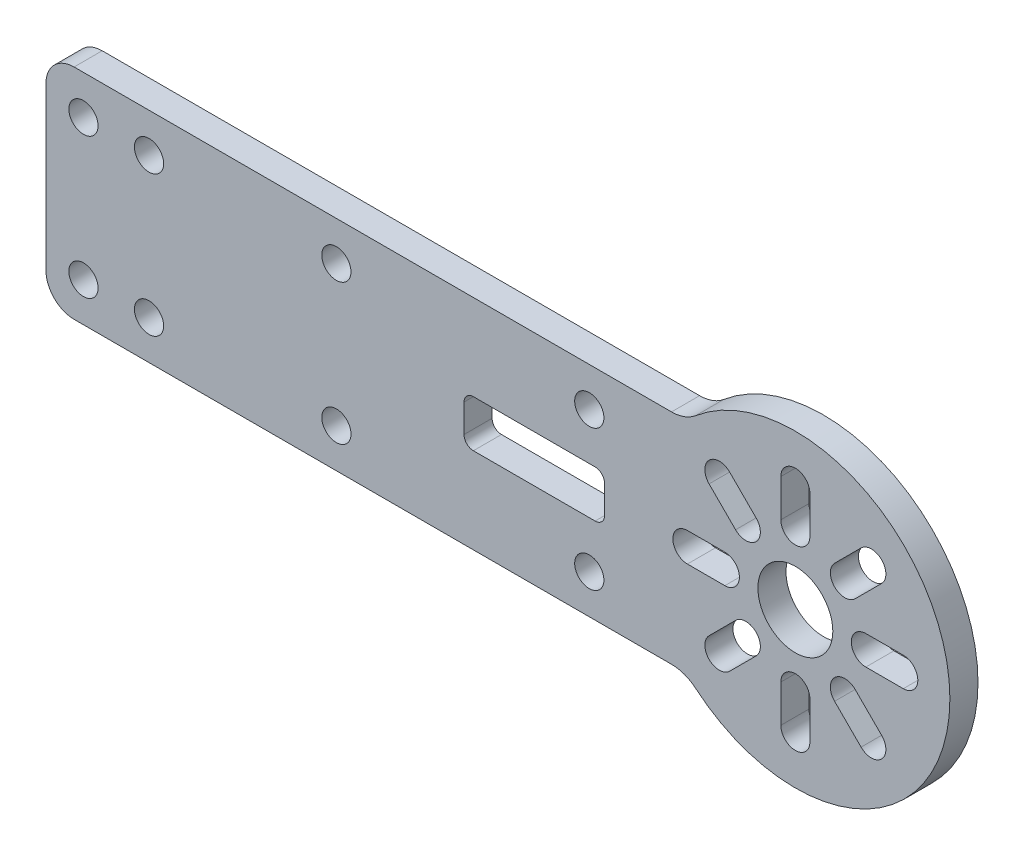
from build123d import *

# Parameters (mm, degrees)
SKETCH_1_R      = 4
SKETCH_1_R_2    = 1.56
EXTRUDE_3_DEPTH = 3


with BuildPart() as part:
    # 草图1 → 凸台-拉伸3 (new body)
    with BuildSketch(Plane.XY):
        with BuildLine():
            Line((-13.220699864, 11.66726189), (-77, 11.66726189))
            ThreePointArc((-77, 11.66726189), (-79.121320344, 10.788582233), (-80, 8.66726189))
            Line((-80, 8.66726189), (-80, -8.66726189))
            ThreePointArc((-80, -8.66726189), (-79.121320344, -10.788582233), (-77, -11.66726189))
            Line((-77, -11.66726189), (-13.220699864, -11.66726189))
            ThreePointArc((-13.220699864, -11.66726189), (-11.847402161, -11.910394389), (-10.64105111, -12.610235179))
            ThreePointArc((-10.64105111, -12.610235179), (16.5, 0), (-10.64105111, 12.610235179))
            ThreePointArc((-10.64105111, 12.610235179), (-11.847402161, 11.910394389), (-13.220699864, 11.66726189))
        make_face()
        Circle(SKETCH_1_R, mode=Mode.SUBTRACT)
        with Locations((-76, 7.5)):
            Circle(SKETCH_1_R_2, mode=Mode.SUBTRACT)
        with Locations((-76, -7.5)):
            Circle(SKETCH_1_R_2, mode=Mode.SUBTRACT)
        with Locations((-69, 7.5)):
            Circle(SKETCH_1_R_2, mode=Mode.SUBTRACT)
        with Locations((-69, -7.5)):
            Circle(SKETCH_1_R_2, mode=Mode.SUBTRACT)
        with Locations((-49, 7.5)):
            Circle(SKETCH_1_R_2, mode=Mode.SUBTRACT)
        with Locations((-49, -7.5)):
            Circle(SKETCH_1_R_2, mode=Mode.SUBTRACT)
        with Locations((-22, 7.5)):
            Circle(SKETCH_1_R_2, mode=Mode.SUBTRACT)
        with Locations((-22, -7.5)):
            Circle(SKETCH_1_R_2, mode=Mode.SUBTRACT)
        with BuildLine():
            Line((-11.525767243, 1.55), (-7.525767243, 1.55))
            ThreePointArc((-7.525767243, 1.55), (-5.975767243, 0), (-7.525767243, -1.55))
            Line((-7.525767243, -1.55), (-11.525767243, -1.55))
            ThreePointArc((-11.525767243, -1.55), (-13.075767243, 0), (-11.525767243, 1.55))
        make_face(mode=Mode.SUBTRACT)
        with BuildLine():
            Line((11.525767243, 1.55), (7.525767243, 1.55))
            ThreePointArc((7.525767243, 1.55), (5.975767243, 0), (7.525767243, -1.55))
            Line((7.525767243, -1.55), (11.525767243, -1.55))
            ThreePointArc((11.525767243, -1.55), (13.075767243, 0), (11.525767243, 1.55))
        make_face(mode=Mode.SUBTRACT)
        with BuildLine():
            Line((-7.017492281, 9.209523303), (-4.189065156, 6.381096178))
            ThreePointArc((-4.189065156, 6.381096178), (-4.189065156, 4.189065156), (-6.381096178, 4.189065156))
            Line((-6.381096178, 4.189065156), (-9.209523303, 7.017492281))
            ThreePointArc((-9.209523303, 7.017492281), (-9.209523303, 9.209523303), (-7.017492281, 9.209523303))
        make_face(mode=Mode.SUBTRACT)
        with BuildLine():
            Line((1.55, -11.474232757), (1.55, -7.474232757))
            ThreePointArc((1.55, -7.474232757), (0, -5.924232757), (-1.55, -7.474232757))
            Line((-1.55, -7.474232757), (-1.55, -11.474232757))
            ThreePointArc((-1.55, -11.474232757), (0, -13.024232757), (1.55, -11.474232757))
        make_face(mode=Mode.SUBTRACT)
        with BuildLine():
            Line((1.55, 11.525767243), (1.55, 7.525767243))
            ThreePointArc((1.55, 7.525767243), (0, 5.975767243), (-1.55, 7.525767243))
            Line((-1.55, 7.525767243), (-1.55, 11.525767243))
            ThreePointArc((-1.55, 11.525767243), (0, 13.075767243), (1.55, 11.525767243))
        make_face(mode=Mode.SUBTRACT)
        with BuildLine():
            Line((7.017492281, 9.209523303), (4.189065156, 6.381096178))
            ThreePointArc((4.189065156, 6.381096178), (4.189065156, 4.189065156), (6.381096178, 4.189065156))
            Line((6.381096178, 4.189065156), (9.209523303, 7.017492281))
            ThreePointArc((9.209523303, 7.017492281), (9.209523303, 9.209523303), (7.017492281, 9.209523303))
        make_face(mode=Mode.SUBTRACT)
        with BuildLine():
            Line((-7.017492281, -9.209523303), (-4.189065156, -6.381096178))
            ThreePointArc((-4.189065156, -6.381096178), (-4.189065156, -4.189065156), (-6.381096178, -4.189065156))
            Line((-6.381096178, -4.189065156), (-9.209523303, -7.017492281))
            ThreePointArc((-9.209523303, -7.017492281), (-9.209523303, -9.209523303), (-7.017492281, -9.209523303))
        make_face(mode=Mode.SUBTRACT)
        with BuildLine():
            Line((7.017492281, -9.209523303), (4.189065156, -6.381096178))
            ThreePointArc((4.189065156, -6.381096178), (4.189065156, -4.189065156), (6.381096178, -4.189065156))
            Line((6.381096178, -4.189065156), (9.209523303, -7.017492281))
            ThreePointArc((9.209523303, -7.017492281), (9.209523303, -9.209523303), (7.017492281, -9.209523303))
        make_face(mode=Mode.SUBTRACT)
        with BuildLine():
            Line((-34.37331228, 2.5), (-21.37331228, 2.5))
            ThreePointArc((-21.37331228, 2.5), (-20.666205499, 2.207106781), (-20.37331228, 1.5))
            Line((-20.37331228, 1.5), (-20.37331228, -1.5))
            ThreePointArc((-20.37331228, -1.5), (-20.666205499, -2.207106781), (-21.37331228, -2.5))
            Line((-21.37331228, -2.5), (-34.37331228, -2.5))
            ThreePointArc((-34.37331228, -2.5), (-35.080419062, -2.207106781), (-35.37331228, -1.5))
            Line((-35.37331228, -1.5), (-35.37331228, 1.5))
            ThreePointArc((-35.37331228, 1.5), (-35.080419062, 2.207106781), (-34.37331228, 2.5))
        make_face(mode=Mode.SUBTRACT)
    extrude(amount=EXTRUDE_3_DEPTH)


solid = part.part
